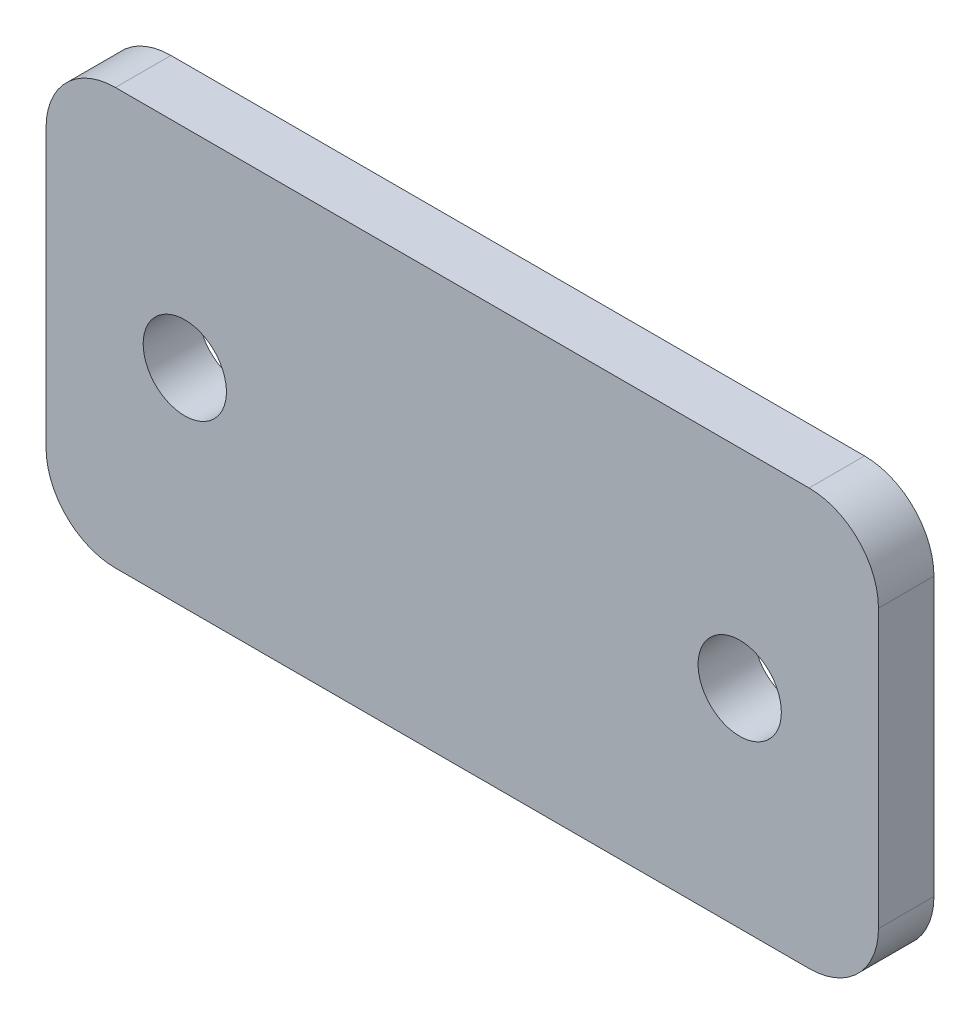
from build123d import *

# Parameters (mm, degrees)
MODEL_R             = 1.5
BOSS_EXTRUDE1_DEPTH = 2


with BuildPart() as part:
    # Model → Boss-Extrude1 (new body)
    with BuildSketch(Plane.XY):
        with BuildLine():
            Line((-12.5, 15), (12.5, 15))
            ThreePointArc((12.5, 15), (14.267766953, 14.267766953), (15, 12.5))
            Line((15, 12.5), (15, 2.5))
            ThreePointArc((15, 2.5), (14.267766953, 0.732233047), (12.5, 0))
            Line((12.5, 0), (-12.5, 0))
            ThreePointArc((-12.5, 0), (-14.267766953, 0.732233047), (-15, 2.5))
            Line((-15, 2.5), (-15, 12.5))
            ThreePointArc((-15, 12.5), (-14.267766953, 14.267766953), (-12.5, 15))
        make_face()
        with Locations((10, 7.5)):
            Circle(MODEL_R, mode=Mode.SUBTRACT)
        with Locations(Location((-10, 7.5, 0), (0, 0, 180))):
            Circle(MODEL_R, mode=Mode.SUBTRACT)
    extrude(amount=BOSS_EXTRUDE1_DEPTH)


solid = part.part
